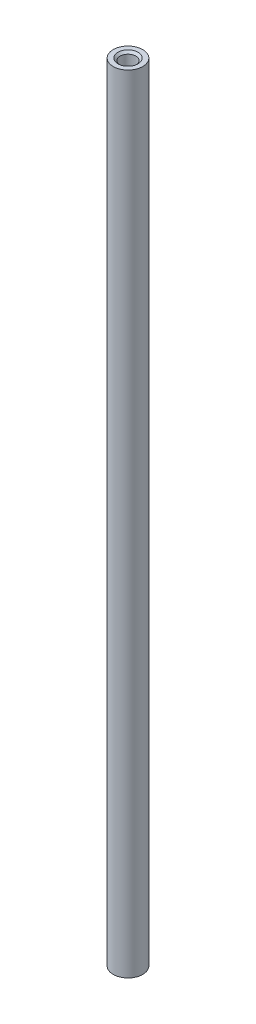
from build123d import *

# Parameters (mm, degrees)
SKETCH1_R                   = 1.5
BOSS_EXTRUDE1_DEPTH         = 80
M2_TAPPED_HOLE1_D           = 1.6
M2_TAPPED_HOLE1_DEPTH       = 8
M2_TAPPED_HOLE1_CSINK_D     = 2.05
M2_TAPPED_HOLE1_CSINK_ANGLE = 90
M2_TAPPED_HOLE1_TIP         = 0.480688495
M2_TAPPED_HOLE2_D           = 1.6
M2_TAPPED_HOLE2_DEPTH       = 8
M2_TAPPED_HOLE2_CSINK_D     = 2.05
M2_TAPPED_HOLE2_CSINK_ANGLE = 90
M2_TAPPED_HOLE2_TIP         = 0.480688495


with BuildPart() as part:
    # Sketch1 → Boss-Extrude1 (new body)
    with BuildSketch(Plane(origin=(0, 0, 0), x_dir=(1, 0, 0), z_dir=(0, 1, 0))):
        with Locations(Location((0, 0, 0), (0, 0, 270))):
            Circle(SKETCH1_R)
    extrude(amount=BOSS_EXTRUDE1_DEPTH)

    # M2 Tapped Hole1
    with Locations(Plane(origin=(0, 80, 0), x_dir=(1, 0, 0), z_dir=(0, 1, 0))):
        with Locations((0, 0)):
            CounterSinkHole(M2_TAPPED_HOLE1_D / 2, M2_TAPPED_HOLE1_CSINK_D / 2, depth=M2_TAPPED_HOLE1_DEPTH, counter_sink_angle=M2_TAPPED_HOLE1_CSINK_ANGLE)
            with Locations((0, 0, -(M2_TAPPED_HOLE1_DEPTH + M2_TAPPED_HOLE1_TIP / 2))):  # 118° drill point
                Cone(0, M2_TAPPED_HOLE1_D / 2, M2_TAPPED_HOLE1_TIP, mode=Mode.SUBTRACT)

    # M2 Tapped Hole2
    with Locations(Plane(origin=(0, 0, 0), x_dir=(-1, 0, 0), z_dir=(0, -1, 0))):
        with Locations((0, 0)):
            CounterSinkHole(M2_TAPPED_HOLE2_D / 2, M2_TAPPED_HOLE2_CSINK_D / 2, depth=M2_TAPPED_HOLE2_DEPTH, counter_sink_angle=M2_TAPPED_HOLE2_CSINK_ANGLE)
            with Locations((0, 0, -(M2_TAPPED_HOLE2_DEPTH + M2_TAPPED_HOLE2_TIP / 2))):  # 118° drill point
                Cone(0, M2_TAPPED_HOLE2_D / 2, M2_TAPPED_HOLE2_TIP, mode=Mode.SUBTRACT)


solid = part.part
